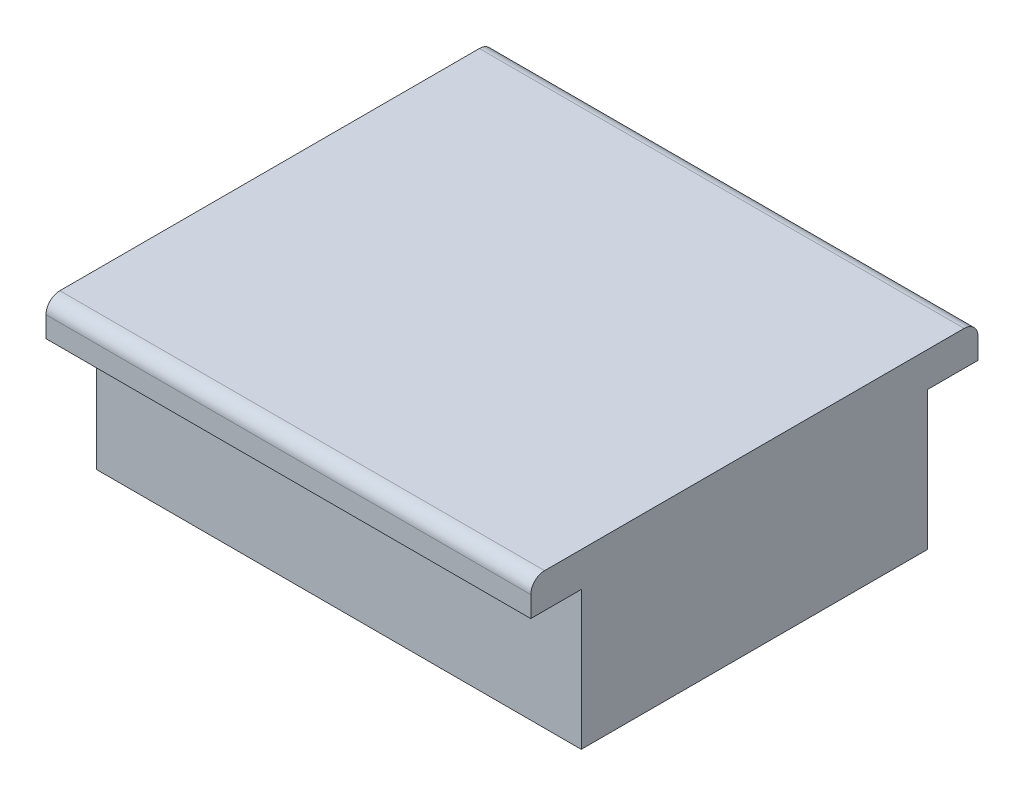
from build123d import *

# Parameters (mm, degrees)
BOSS_EXTRUDE1_DEPTH = 1778


with BuildPart() as part:
    # Sketch1 → Boss-Extrude1 (new body)
    with BuildSketch(Plane(origin=(0, 0, 0), x_dir=(0, 0, -1), z_dir=(1, 0, 0))):
        with BuildLine():
            Line((0, 0), (1270, 0))
            Line((1270, 0), (1270, 508))
            Line((1270, 508), (1455.096882898, 508))
            Line((1455.096882898, 508), (1455.096882898, 584.2))
            ThreePointArc((1455.096882898, 584.2), (1440.217907382, 620.121024484), (1404.296882898, 635))
            Line((1404.296882898, 635), (-134.296882898, 635))
            ThreePointArc((-134.296882898, 635), (-170.217907382, 620.121024484), (-185.096882898, 584.2))
            Line((-185.096882898, 584.2), (-185.096882898, 508))
            Line((-185.096882898, 508), (0, 508))
            Line((0, 508), (0, 0))
        make_face()
    extrude(amount=BOSS_EXTRUDE1_DEPTH)


solid = part.part
